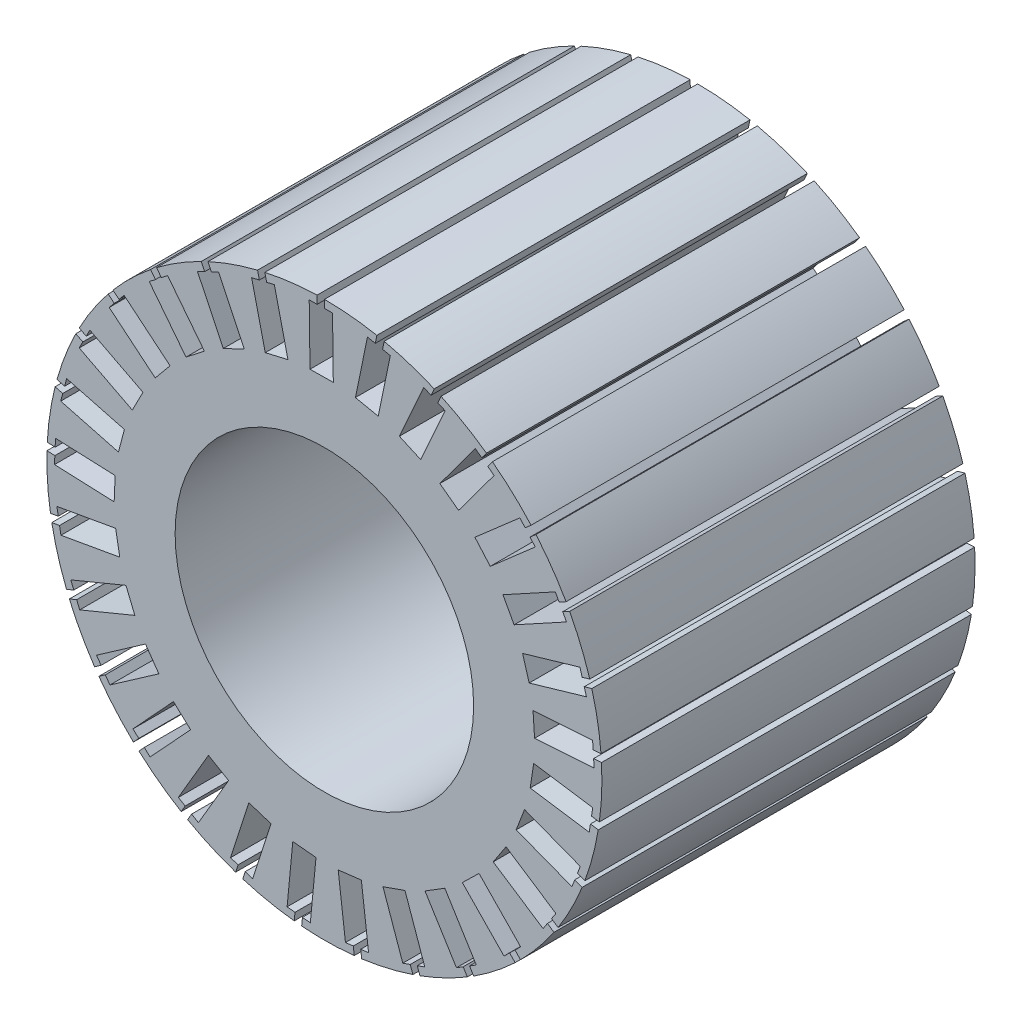
from build123d import *

# Parameters (mm, degrees)
ROTOR_STACK_START = -20
SKETCH_1_R        = 29.75
SKETCH_1_R_2      = 16
ROTOR_STACK_DEPTH = 40
ROTOR_SLOTS_DEPTH = 21


with BuildPart() as part:
    # Эскиз1 → Rotor_stack (new body)
    with BuildSketch(Plane.XY.offset(ROTOR_STACK_START)):
        Circle(SKETCH_1_R)
        Circle(SKETCH_1_R_2, mode=Mode.SUBTRACT)
    extrude(amount=ROTOR_STACK_DEPTH)

    # Эскиз2 → Rotor_slots (cut, symmetric)
    with BuildSketch(Plane.XY):
        Polygon((30.70491713, 1.664501137), (28.861684244, 1.540513747), (28.918731651, 0.692430264), (22.533161901, 0.262896843), (22.365375408, 2.757260027), (28.750945159, 3.186793448), (28.807992566, 2.338709965), (30.651225452, 2.462697356), align=None)
        Polygon((29.629234689, 8.226235577), (27.855749187, 7.708906358), (28.093775737, 6.892914103), (21.949834048, 5.100714194), (21.249755958, 7.500691416), (27.393697648, 9.292891325), (27.631724198, 8.47689907), (29.4052097, 8.994228289), align=None)
        Polygon((27.168122163, 14.403320385), (25.547310257, 13.516839077), (25.955186093, 12.771092939), (20.34015635, 9.700027818), (19.140521537, 11.893398812), (24.755551281, 14.964463933), (25.163427117, 14.218717795), (26.784239023, 15.105199103), align=None)
        Polygon((23.436658441, 19.90692194), (22.044307494, 18.692739423), (22.602960795, 18.052109663), (17.779395547, 13.845778923), (16.136297602, 15.729984098), (20.959862849, 19.936314838), (21.518516151, 19.295685079), (22.910867099, 20.509867596), align=None)
        Polygon((18.609322618, 24.479697949), (17.510537412, 22.994588049), (18.193846171, 22.489029803), (14.387289969, 17.344116793), (12.377558325, 18.83105281), (16.184114527, 23.97596582), (16.867423286, 23.470407574), (17.966208492, 24.955517475), align=None)
        Polygon((12.911835552, 27.90783049), (12.157994063, 26.221235294), (12.934007522, 25.874387904), (10.322450703, 20.031463039), (8.040058177, 21.051602421), (10.651614996, 26.894527287), (11.427628455, 26.547679897), (12.181469944, 28.234275092), align=None)
        Polygon((6.610605407, 30.031023895), (6.236956424, 28.22180672), (7.069389055, 28.049888385), (5.774945114, 21.782160337), (3.326613846, 22.287802501), (4.621057787, 28.555530549), (5.453490418, 28.383612213), (5.827139401, 30.192829387), align=None)
        Polygon((0.000270699, 30.749999999), (0.024285634, 28.90275783), (0.874213814, 28.913807259), (0.95740951, 22.514348026), (-1.542379252, 22.481849707), (-1.625574949, 28.88130894), (-0.77564677, 28.892358368), (-0.799661705, 30.739600537), align=None)
        Polygon((-6.610076666, 30.031140279), (-6.189520724, 28.232248107), (-5.361838694, 28.425748641), (-3.904893498, 22.193789824), (-6.339252411, 21.624670607), (-7.796197607, 27.856629424), (-6.968515576, 28.050129958), (-7.389071518, 29.84902213), align=None)
        Polygon((-12.911344193, 27.908057817), (-12.113911973, 26.241629841), (-11.347177584, 26.60853361), (-8.584608027, 20.835474677), (-10.839709172, 19.756345944), (-13.602278729, 25.529404877), (-12.83554434, 25.896308646), (-13.632976559, 27.562736623), align=None)
        Polygon((-18.608891615, 24.48002559), (-17.471870162, 23.023982128), (-16.801935061, 23.547133121), (-12.862915825, 18.502915891), (-14.83331318, 16.964236502), (-18.772332416, 22.008453732), (-18.102397316, 22.531604724), (-19.239418768, 23.987648185), align=None)
        Polygon((-23.436307947, 19.907334573), (-22.01286312, 18.729758601), (-21.471052729, 19.384694857), (-16.539767975, 15.305181323), (-18.13332795, 13.378898216), (-23.064612703, 17.45841175), (-22.522802312, 18.113348007), (-23.946247139, 19.290923979), align=None)
        Polygon((-27.167868568, 14.403798717), (-25.524559065, 13.559752378), (-25.136207835, 14.315849807), (-19.443238958, 11.391793486), (-20.585448458, 9.167977519), (-26.278417335, 12.092033839), (-25.890066105, 12.848131268), (-27.533375608, 13.692177607), align=None)
        Polygon((-29.629089849, 8.226757242), (-27.842754996, 7.755707204), (-27.626021799, 8.57761153), (-21.437565696, 6.945738047), (-22.075016276, 4.528372382), (-28.263472378, 6.160245865), (-28.046739181, 6.982150191), (-29.833074035, 7.453200229), align=None)
        Polygon((-30.704887819, 1.665041741), (-28.859054648, 1.589013781), (-28.824073688, 2.438293672), (-22.429495689, 2.174907617), (-22.532380867, -0.322974414), (-28.926958866, -0.059588359), (-28.891977905, 0.789691532), (-30.737811076, 0.865719491), align=None)
        Polygon((-30.344959361, -4.974529261), (-28.52593698, -4.65198016), (-28.674343927, -3.815036088), (-22.372647392, -2.697619077), (-21.936156372, -5.159219286), (-28.237852907, -6.276636298), (-28.386259854, -5.439692226), (-30.205282235, -5.762241328), align=None)
        Polygon((-28.566134329, -11.381496803), (-26.858978203, -10.675452679), (-27.183833713, -9.889979002), (-21.269678968, -7.4440081), (-20.314221585, -9.754224798), (-26.22837633, -12.200195699), (-26.55323184, -11.414722022), (-28.260387967, -12.120766146), align=None)
        Polygon((-25.451588605, -17.256278205), (-23.936123457, -16.199752895), (-24.422237648, -15.502477488), (-19.172163995, -11.842323579), (-17.742416374, -13.893133599), (-22.992490027, -17.553287509), (-23.478604218, -16.856012102), (-24.994069366, -17.912537411), align=None)
        Polygon((-21.146954885, -22.324175216), (-19.89404218, -20.966570671), (-20.518684893, -20.390097358), (-16.178179942, -15.686905168), (-14.340995493, -17.382414915), (-18.681500444, -22.085607104), (-19.306143157, -21.50913379), (-20.559055862, -22.866738335), align=None)
        Polygon((-15.853513058, -26.348218606), (-14.921737603, -24.753014906), (-15.655701238, -24.324298936), (-12.427722176, -18.797984507), (-10.269005602, -20.058913828), (-13.496984664, -25.585228257), (-14.230948299, -25.156512288), (-15.162723754, -26.751715989), align=None)
        Polygon((-9.81877858, -29.140248578), (-9.251709159, -27.382035674), (-10.060674393, -27.121123332), (-8.096157933, -21.030090982), (-5.716848422, -21.797480224), (-7.681364881, -27.888512573), (-8.490330115, -27.627600231), (-9.057399537, -29.385813136), align=None)
        Polygon((-3.324928929, -30.569712914), (-3.149081077, -28.730702887), (-3.995221595, -28.649794143), (-3.386026344, -22.278853777), (-0.897377763, -22.516820671), (-1.506573014, -28.887761037), (-2.352713532, -28.806852293), (-2.528561383, -30.64586232), align=None)
        Polygon((3.324390704, -30.569771449), (3.100794535, -28.735954365), (2.257043325, -28.838832421), (1.482432074, -22.48588213), (3.964053282, -22.18329961), (4.738664533, -28.536249902), (3.894913322, -28.639127958), (4.118509491, -30.472945043), align=None)
        Polygon((9.818265522, -29.140421447), (9.205680442, -27.397544554), (8.403771407, -27.679398948), (6.281573616, -21.641495625), (8.640129601, -20.812512113), (10.762327392, -26.850415436), (9.960418357, -27.13226983), (10.573003438, -28.875146724), align=None)
        Polygon((15.853049157, -26.348497726), (14.880118962, -24.778056011), (14.157548478, -25.225707544), (10.786995757, -19.785176839), (12.912203064, -18.468554682), (16.282755785, -23.909085387), (15.560185301, -24.35673692), (16.533115495, -25.927178636), align=None)
        Polygon((21.146561833, -22.324547535), (19.858779658, -20.999973107), (19.249334318, -21.592490091), (14.788029965, -17.003725173), (16.580516262, -15.26102816), (21.041820614, -19.849793078), (20.432375273, -20.442310063), (21.720157447, -21.766884491), align=None)
        Polygon((25.451284779, -17.256726314), (23.908865889, -16.2399548), (23.441042678, -16.9496318), (18.097592328, -13.427198216), (19.473542947, -11.339912923), (24.816993297, -14.862346507), (24.349170087, -15.572023506), (25.891588977, -16.58879502), align=None)
        Polygon((28.565933937, -11.381999749), (26.841000123, -10.720574257), (26.536673936, -11.514227564), (20.560931388, -9.222830393), (21.456008407, -6.88855596), (27.431750956, -9.179953131), (27.127424769, -9.973606438), (28.852358583, -10.635031931), align=None)
        Polygon((30.344871773, -4.975063527), (28.518079023, -4.699911576), (28.391479815, -5.540430844), (22.062864148, -4.587213273), (22.435214761, -2.115097778), (28.763830428, -3.068315349), (28.63723122, -3.908834617), (30.464023969, -4.183986569), align=None)
    extrude(amount=ROTOR_SLOTS_DEPTH, both=True, mode=Mode.SUBTRACT)


solid = part.part
